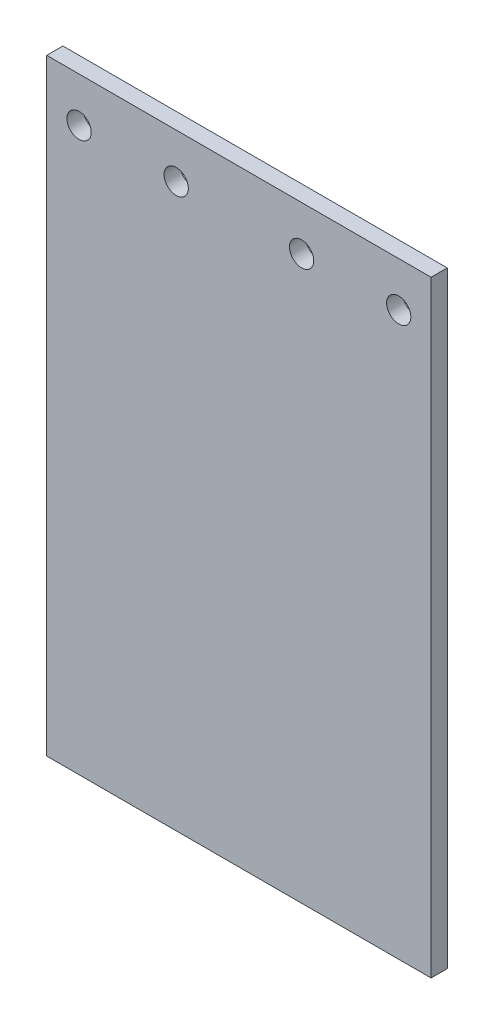
from build123d import *

# Parameters (mm, degrees)
SKETCH_1_W          = 95
SKETCH_1_H          = 150
EXTRUDE_1_DEPTH     = 4
SKETCH_2_R          = 3
CUT_EXTRUDE_1_DEPTH = 89.866472868


with BuildPart() as part:
    # 草图1 → 凸台-拉伸1 (new body)
    with BuildSketch(Plane.XY):
        Rectangle(SKETCH_1_W, SKETCH_1_H)
    extrude(amount=EXTRUDE_1_DEPTH)

    # 草图2 → 切除-拉伸1 (cut, through all)
    with BuildSketch(Plane.XY.offset(4)):
        with Locations((-39.5, 64)):
            Circle(SKETCH_2_R)
        with Locations((-15.5, 64)):
            Circle(SKETCH_2_R)
    cut_extrude_1 = extrude(amount=-CUT_EXTRUDE_1_DEPTH, mode=Mode.SUBTRACT)

    # 镜向1: 切除-拉伸1 across plane
    add(cut_extrude_1.mirror(Plane(origin=(0, 0, 0), x_dir=(0, 0, 1), z_dir=(1, 0, 0))), mode=Mode.SUBTRACT)


solid = part.part
